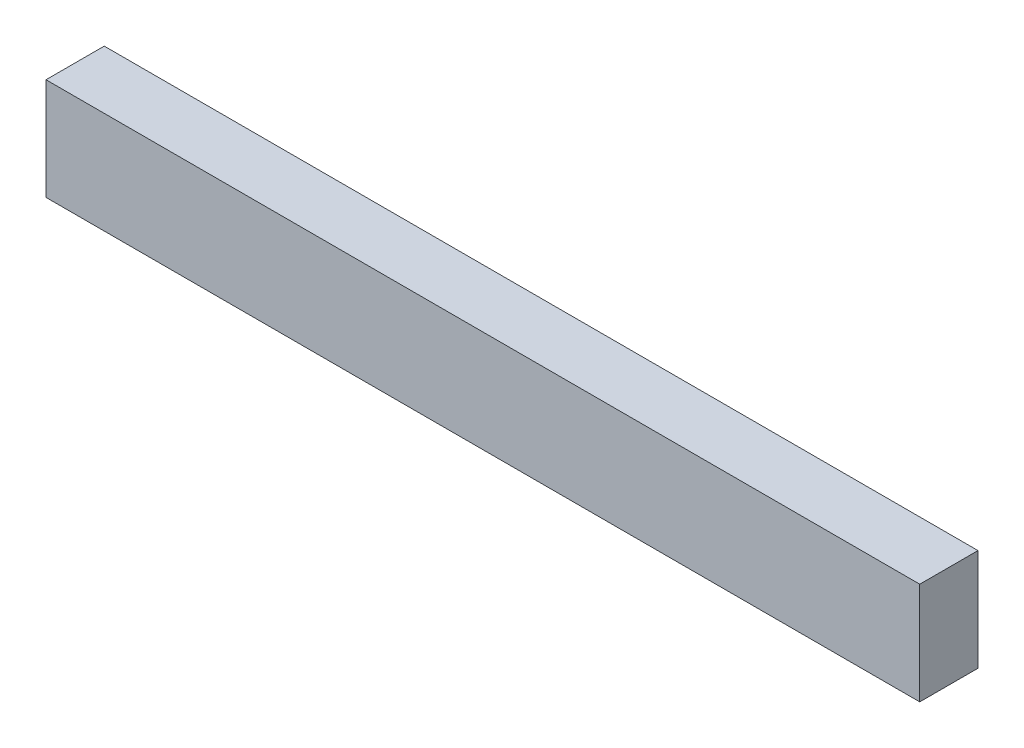
from build123d import *

# Parameters (mm, degrees)
SKETCH1_W           = 152.4
SKETCH1_H           = 17.78
BOSS_EXTRUDE1_DEPTH = 10.16


with BuildPart() as part:
    # Sketch1 → Boss-Extrude1 (new body)
    with BuildSketch(Plane.XY):
        with Locations((61.712592593, 7.326018519)):
            Rectangle(SKETCH1_W, SKETCH1_H)
    extrude(amount=BOSS_EXTRUDE1_DEPTH)


solid = part.part
